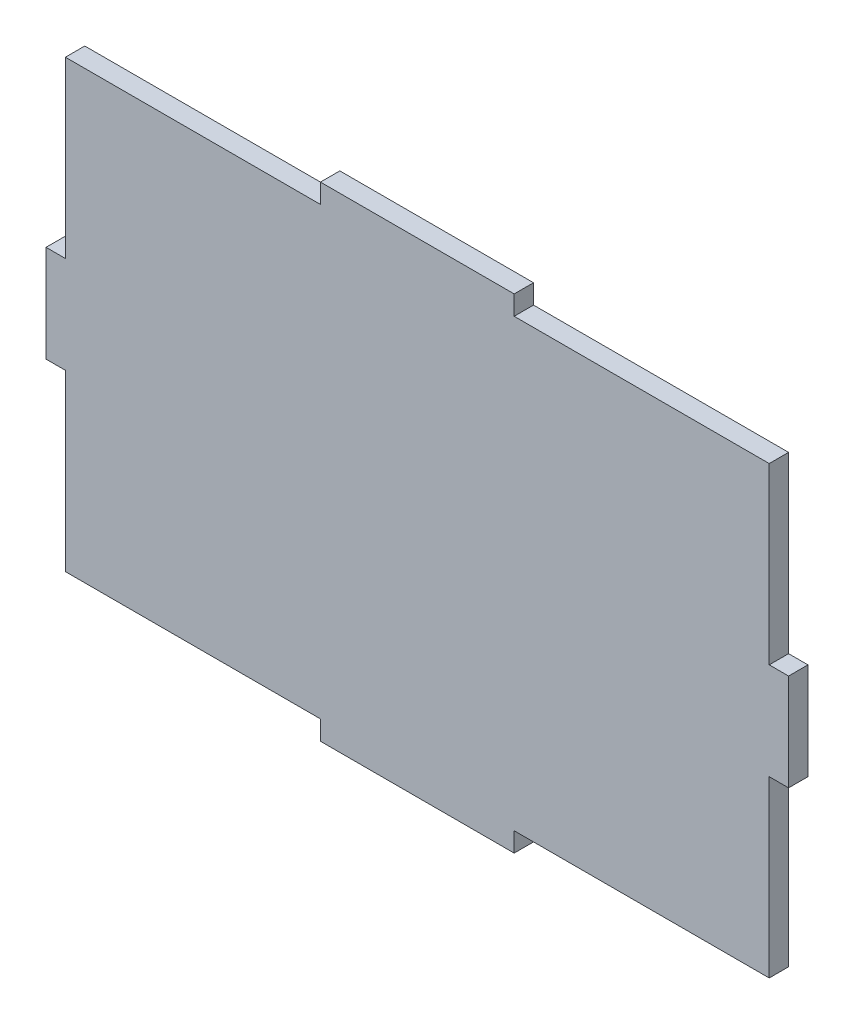
from build123d import *

# Parameters (mm, degrees)
BOSS_EXTRUDE1_DEPTH = 3


with BuildPart() as part:
    # Sketch1 → Boss-Extrude1 (new body)
    with BuildSketch(Plane.XY):
        Polygon((3, 45), (0, 45), (0, 30), (3, 30), (3, 3), (42.5, 3), (42.5, 0), (72.5, 0), (72.5, 3), (112, 3), (112, 30), (115, 30), (115, 45), (112, 45), (112, 72), (72.5, 72), (72.5, 75), (42.5, 75), (42.5, 72), (3, 72), align=None)
    extrude(amount=BOSS_EXTRUDE1_DEPTH)


solid = part.part
